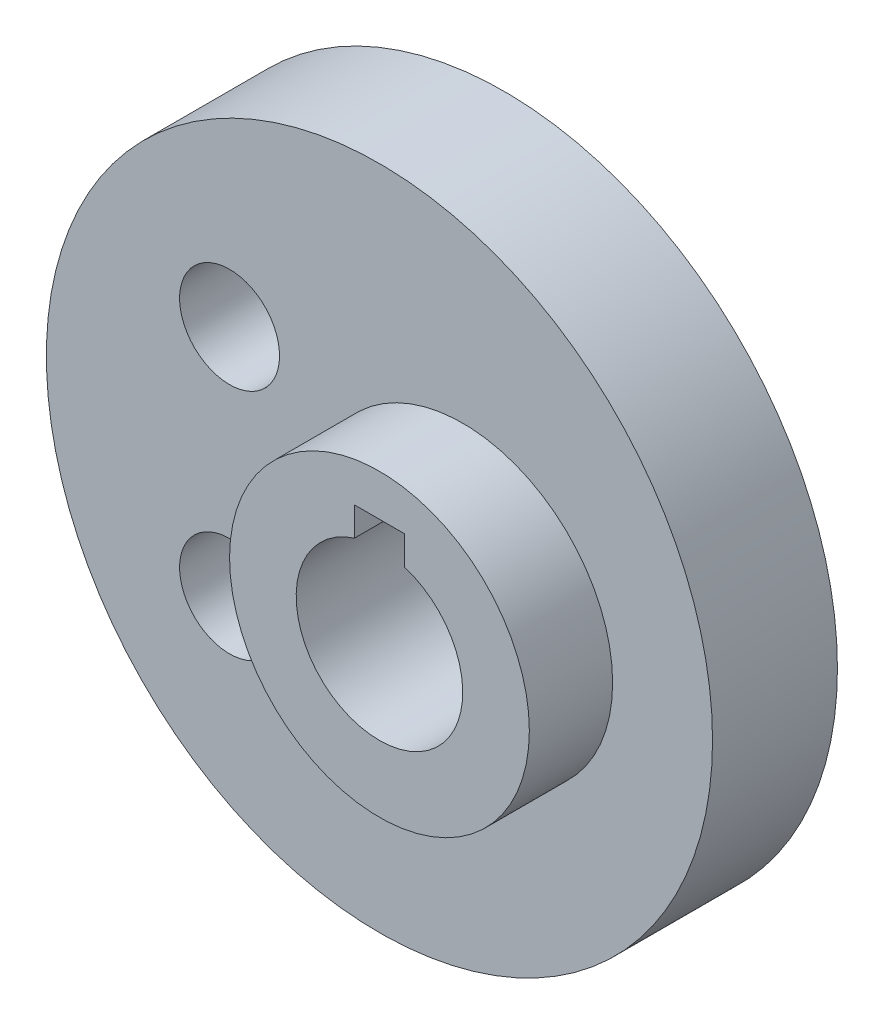
from build123d import *

# Parameters (mm, degrees)
SKETCH_1_R          = 40
EXTRUDE_1_DEPTH     = 15
SKETCH_2_R          = 18
EXTRUDE_2_DEPTH     = 10
SKETCH_3_R          = 10
CUT_EXTRUDE_1_DEPTH = 81
SKETCH_4_W          = 6
SKETCH_4_H          = 13
CUT_EXTRUDE_2_DEPTH = 81
SKETCH_5_R          = 6
CUT_EXTRUDE_3_DEPTH = 62.846584384


with BuildPart() as part:
    # 草图1 → 凸台-拉伸1 (new body)
    with BuildSketch(Plane.XY):
        Circle(SKETCH_1_R)
    extrude(amount=EXTRUDE_1_DEPTH)

    # 草图2 → 凸台-拉伸2 (add)
    with BuildSketch(Plane.XY.offset(15)):
        with Locations((10, 0)):
            Circle(SKETCH_2_R)
    extrude(amount=EXTRUDE_2_DEPTH)

    # 草图3 → 切除-拉伸1 (cut, symmetric)
    with BuildSketch(Plane.XY.offset(25)):
        with Locations((10, 0)):
            Circle(SKETCH_3_R)
    extrude(amount=CUT_EXTRUDE_1_DEPTH, both=True, mode=Mode.SUBTRACT)

    # 草图4 → 切除-拉伸2 (cut, symmetric)
    with BuildSketch(Plane.XY.offset(25)):
        with Locations((10, 6.5)):
            Rectangle(SKETCH_4_W, SKETCH_4_H)
    extrude(amount=CUT_EXTRUDE_2_DEPTH, both=True, mode=Mode.SUBTRACT)

    # 草图5 → 切除-拉伸3 (cut, through all)
    with BuildSketch(Plane.XY):
        with Locations((-18, 14)):
            Circle(SKETCH_5_R)
        with Locations((-18, -14)):
            Circle(SKETCH_5_R)
    extrude(amount=CUT_EXTRUDE_3_DEPTH, mode=Mode.SUBTRACT)


solid = part.part
